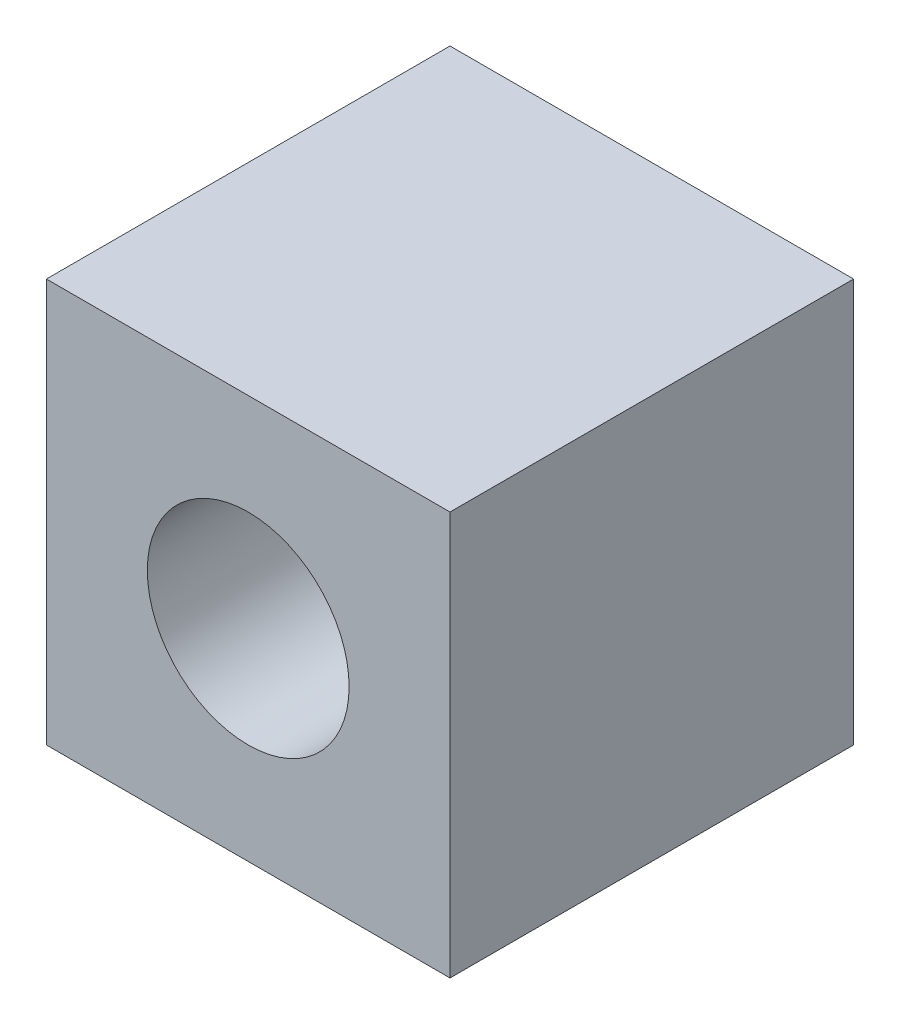
from build123d import *

# Parameters (mm, degrees)
SKETCH2_W           = 100
SKETCH2_H           = 100
BOSS_EXTRUDE1_DEPTH = 100
SKETCH3_R           = 25
CUT_EXTRUDE1_DEPTH  = 151


with BuildPart() as part:
    # Sketch2 → Boss-Extrude1 (new body)
    with BuildSketch(Plane(origin=(0, 0, 0), x_dir=(1, 0, 0), z_dir=(0, 1, 0))):
        Rectangle(SKETCH2_W, SKETCH2_H)
    extrude(amount=BOSS_EXTRUDE1_DEPTH)

    # Sketch3 → Cut-Extrude1 (cut, through all)
    with BuildSketch(Plane.XY.offset(50)):
        with Locations((0, 50)):
            Circle(SKETCH3_R)
    extrude(amount=-CUT_EXTRUDE1_DEPTH, mode=Mode.SUBTRACT)


solid = part.part
